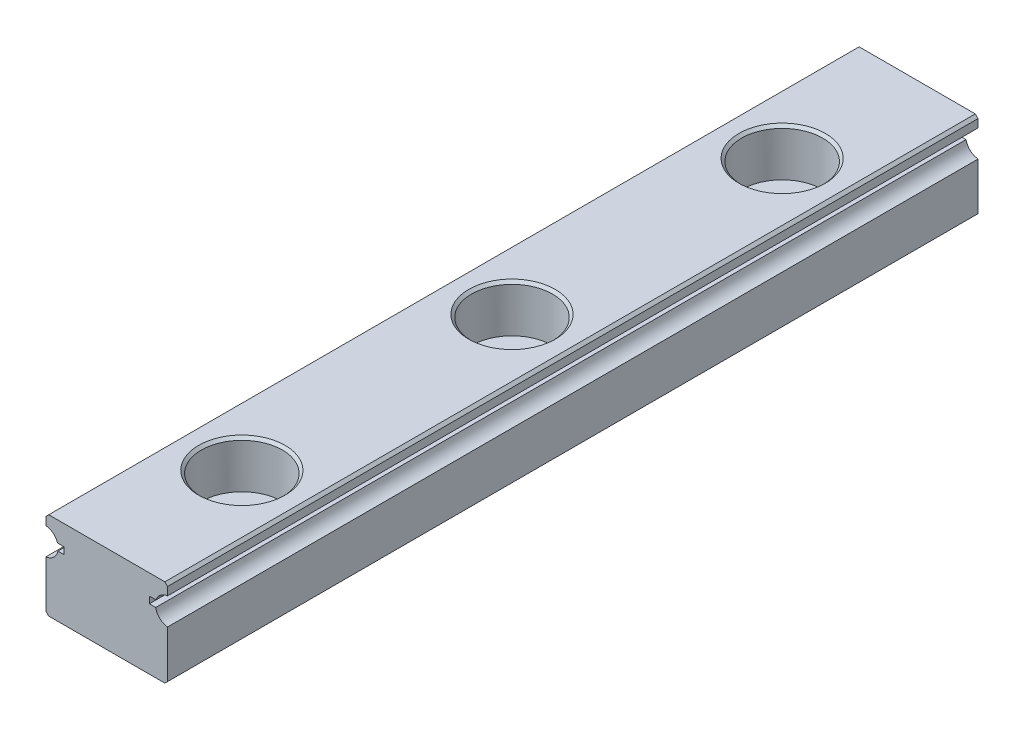
from build123d import *

# Parameters (mm, degrees)
EXTRUDE1_DEPTH             = 60
EXTRUDE2_REACH             = 62.519
SKETCH2_R                  = 1.75
SKETCH_R                   = 3
SKETCH_R_2                 = 1.75
EXTRUDE4_DEPTH             = 3.5
CHAMFER1_SIZE              = 0.2
LPATTERN1_COUNT            = 3
LPATTERN1_PITCH            = 20
CHAMFER1_OF_LPATTERN1_SIZE = 0.2


with BuildPart() as part:
    # Sketch1 → Extrude1 (new body)
    with BuildSketch(Plane.XY):
        with BuildLine():
            Line((-4.3, -3.25), (4.3, -3.25))
            Line((4.3, -3.25), (4.5, -3.05))
            Line((4.5, -3.05), (4.5, 0.455012563))
            ThreePointArc((4.5, 0.455012563), (3.924845827, 0.712323349), (3.617735397, 1.2625))
            Line((3.617735397, 1.2625), (3.15008224, 1.2625))
            Line((3.15008224, 1.2625), (3.15008224, 1.7625))
            Line((3.15008224, 1.7625), (3.65008224, 1.7625))
            ThreePointArc((3.65008224, 1.7625), (3.973877727, 2.229724887), (4.5, 2.444987437))
            Line((4.5, 2.444987437), (4.5, 3.05))
            Line((4.5, 3.05), (4.3, 3.25))
            Line((4.3, 3.25), (-4.3, 3.25))
            Line((-4.3, 3.25), (-4.5, 3.05))
            Line((-4.5, 3.05), (-4.5, 2.444987437))
            ThreePointArc((-4.5, 2.444987437), (-3.973877727, 2.229724887), (-3.65008224, 1.7625))
            Line((-3.65008224, 1.7625), (-3.15008224, 1.7625))
            Line((-3.15008224, 1.7625), (-3.15008224, 1.2625))
            Line((-3.15008224, 1.2625), (-3.617735397, 1.2625))
            ThreePointArc((-3.617735397, 1.2625), (-3.924845827, 0.712323349), (-4.5, 0.455012563))
            Line((-4.5, 0.455012563), (-4.5, -3.05))
            Line((-4.5, -3.05), (-4.3, -3.25))
        make_face()
    extrude(amount=EXTRUDE1_DEPTH)

    # Sketch2 → Extrude2 (cut, up to next)
    with BuildSketch(Plane(origin=(0, 3.25, 0), x_dir=(1, 0, 0), z_dir=(0, 1, 0)), mode=Mode.PRIVATE) as extrude2_sk1:
        with Locations((0, -10)):
            Circle(SKETCH2_R)
    extrude2_tool1 = extrude(extrude2_sk1.sketch, amount=-EXTRUDE2_REACH, mode=Mode.PRIVATE) & part.part
    extrude2 = extrude2_tool1.solids().sort_by_distance((0, 3.25, 10))[0]
    add(extrude2, mode=Mode.SUBTRACT)

    # Sketch → Extrude4 (cut)
    with BuildSketch(Plane(origin=(0, 3.25, 0), x_dir=(1, 0, 0), z_dir=(0, 1, 0))):
        with Locations((0, -10)):
            Circle(SKETCH_R)
        with Locations((0, -10)):
            Circle(SKETCH_R_2, mode=Mode.SUBTRACT)
    extrude4 = extrude(amount=-EXTRUDE4_DEPTH, mode=Mode.SUBTRACT)

    # Chamfer1
    chamfer1_edges = [part.edges().sort_by_distance(p)[0] for p in [
        (-1.75, -3.25, 10),
        (-3, 3.25, 10),
    ]]
    chamfer(chamfer1_edges, length=CHAMFER1_SIZE)

    # LPattern1: Extrude2, Extrude4 ×3
    with Locations(*[(0, 0, i * LPATTERN1_PITCH) for i in range(1, LPATTERN1_COUNT)]):
        add(extrude2, mode=Mode.SUBTRACT)
        add(extrude4, mode=Mode.SUBTRACT)

    # Chamfer1 of LPattern1
    chamfer1_of_lpattern1_edges = [part.edges().sort_by_distance(p)[0] for p in [
        (-1.75, -3.25, 30),
        (-3, 3.25, 30),
        (-1.75, -3.25, 50),
        (-3, 3.25, 50),
    ]]
    chamfer(chamfer1_of_lpattern1_edges, length=CHAMFER1_OF_LPATTERN1_SIZE)


solid = part.part
